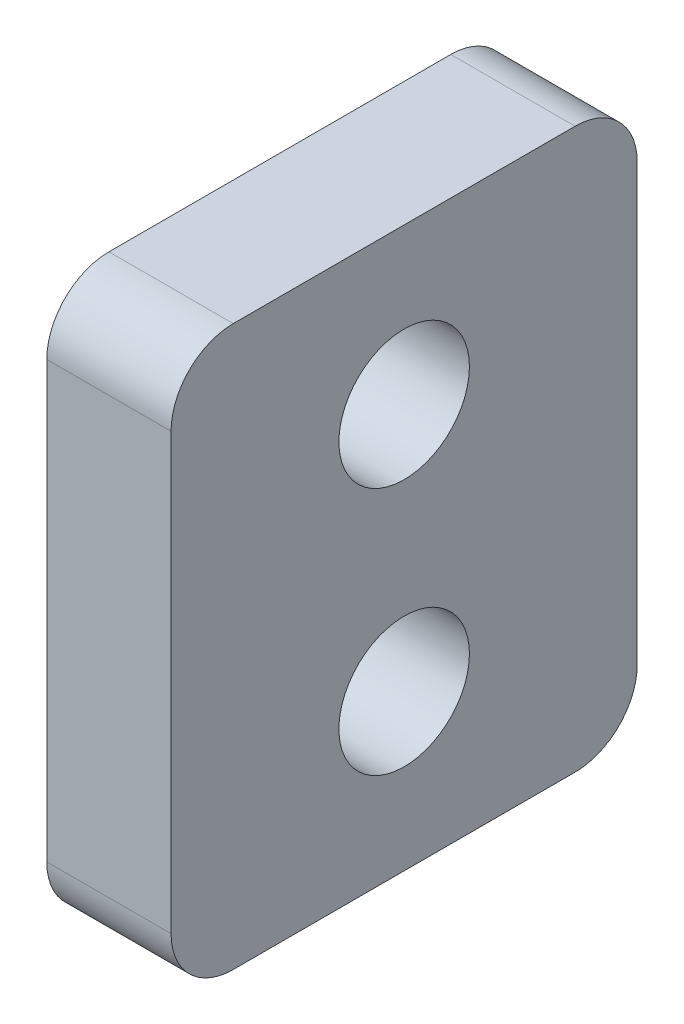
from build123d import *

# Parameters (mm, degrees)
SKETCH4_W           = 15
SKETCH4_H           = 18
SKETCH4_R           = 2.1
BOSS_EXTRUDE1_DEPTH = 4
FILLET1_R           = 2


with BuildPart() as part:
    # Sketch4 → Boss-Extrude1 (new body)
    with BuildSketch(Plane(origin=(0, 0, 0), x_dir=(0, 0, -1), z_dir=(1, 0, 0))):
        Rectangle(SKETCH4_W, SKETCH4_H)
        with Locations((0, 4)):
            Circle(SKETCH4_R, mode=Mode.SUBTRACT)
        with Locations((0, -4)):
            Circle(SKETCH4_R, mode=Mode.SUBTRACT)
    extrude(amount=BOSS_EXTRUDE1_DEPTH)

    # Fillet1
    fillet1_edges = [part.edges().sort_by_distance(p)[0] for p in [
        (2, -9, -7.5),
        (2, -9, 7.5),
        (2, 9, 7.5),
        (2, 9, -7.5),
    ]]
    fillet(fillet1_edges, radius=FILLET1_R)


solid = part.part
